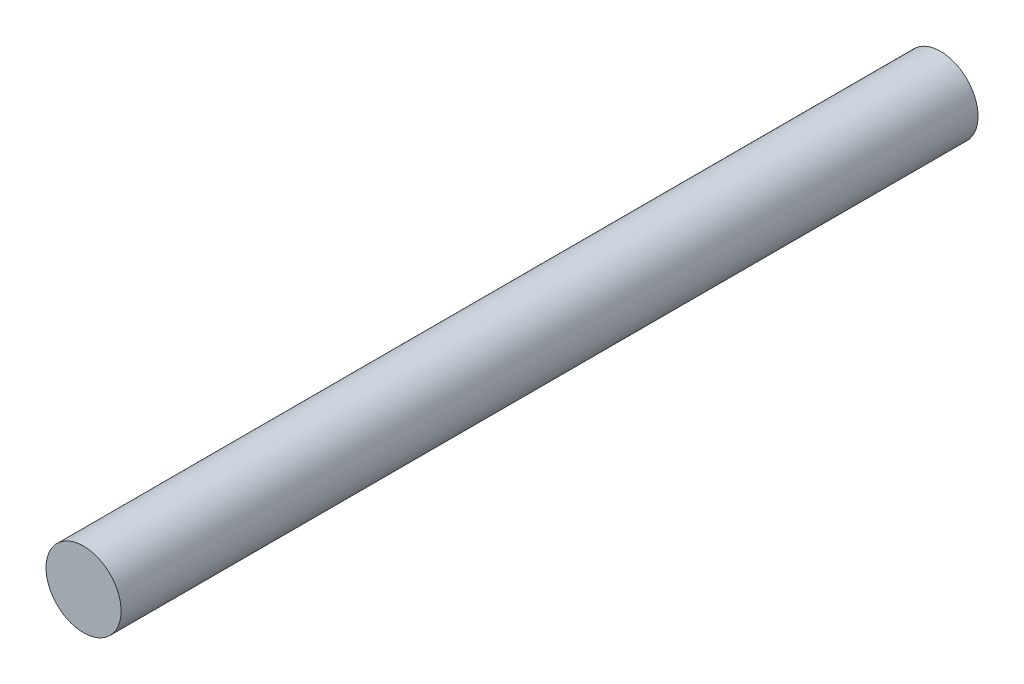
from build123d import *

# Parameters (mm, degrees)
SKETCH2_R           = 7.45
BOSS_EXTRUDE1_DEPTH = 170


with BuildPart() as part:
    # Sketch2 → Boss-Extrude1 (new body)
    with BuildSketch(Plane(origin=(138.381396872, 469.412718149, -1766.689647619), x_dir=(-0.431210304148542, -0.9022514469903177, 0), z_dir=(0, 0, -1))):
        with Locations(Location((61.296841845, 103.289246365, 0), (0, 0, 64.455606369))):
            Circle(SKETCH2_R)
    extrude(amount=BOSS_EXTRUDE1_DEPTH)


solid = part.part
